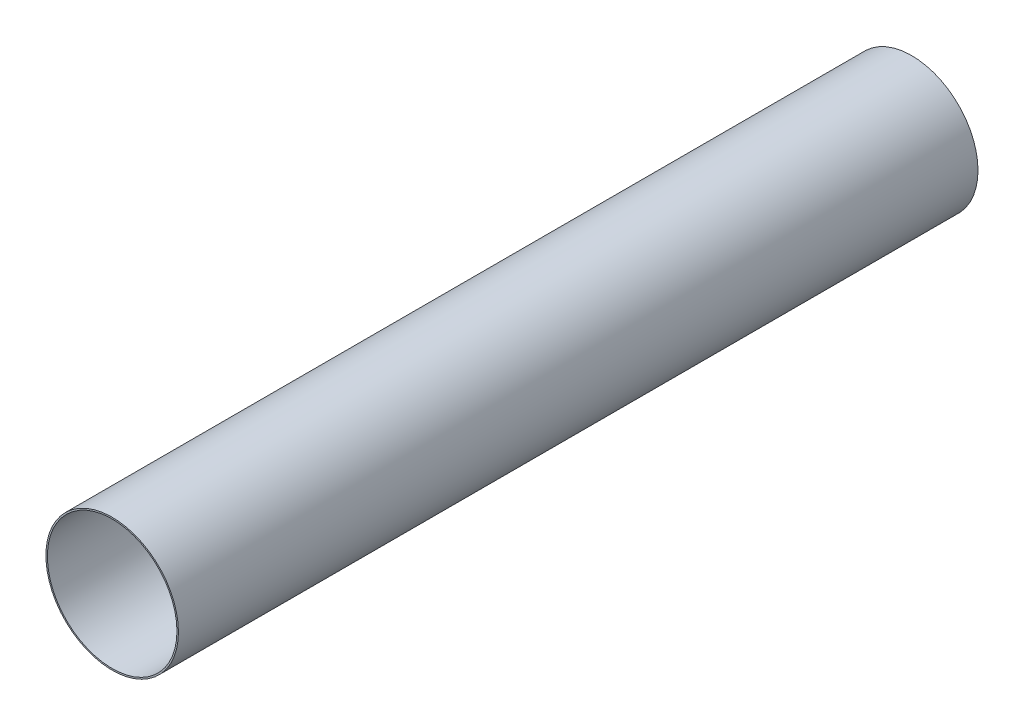
from build123d import *

# Parameters (mm, degrees)
SKETCH1_R           = 50.8
SKETCH1_R_2         = 49.6697
BOSS_EXTRUDE1_DEPTH = 612.775


with BuildPart() as part:
    # Sketch1 → Boss-Extrude1 (new body)
    with BuildSketch(Plane.XY):
        Circle(SKETCH1_R)
        Circle(SKETCH1_R_2, mode=Mode.SUBTRACT)
    extrude(amount=BOSS_EXTRUDE1_DEPTH)


solid = part.part
